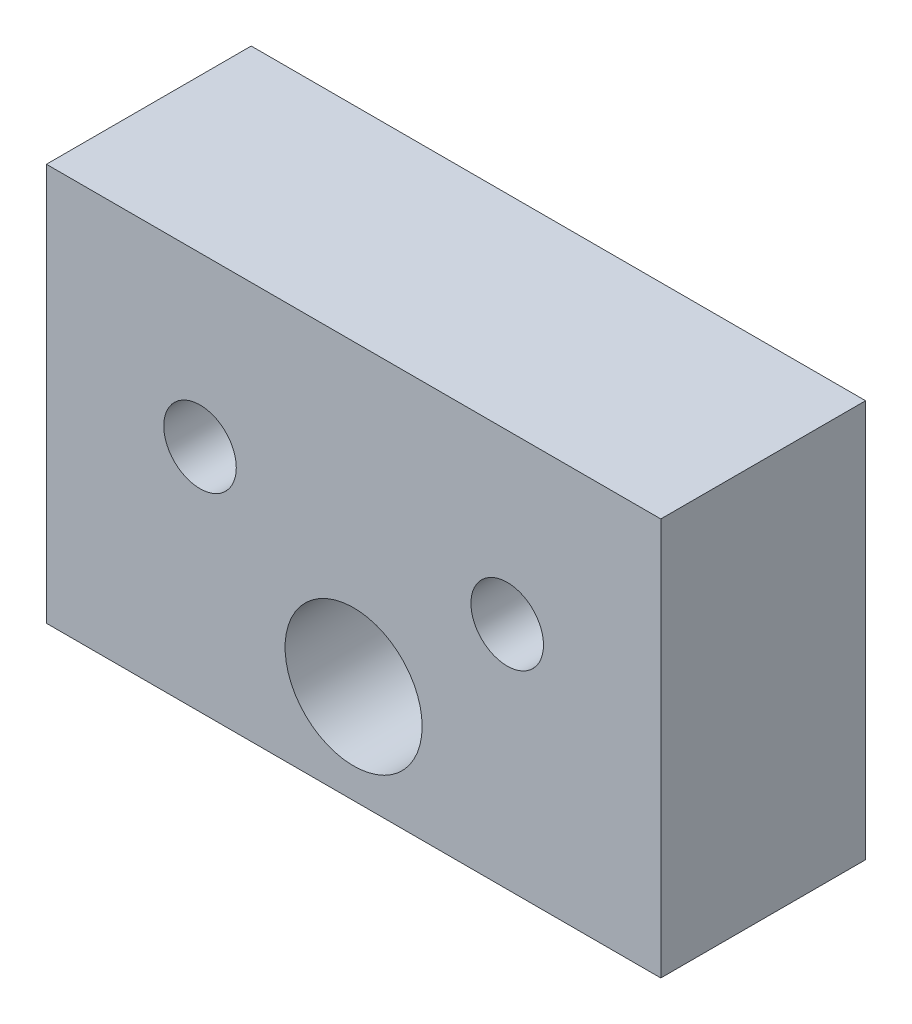
from build123d import *

# Parameters (mm, degrees)
SKETCH1_R           = 4.5
SKETCH1_R_2         = 8.5
BOSS_EXTRUDE1_DEPTH = 12.7


with BuildPart() as part:
    # Sketch1 → Boss-Extrude1 (new, symmetric)
    with BuildSketch(Plane.XY):
        Polygon((-38.1, 37.084), (38.1, 37.084), (38.1, 12.224), (38.1, -12.224), (-38.1, -12.224), (-38.1, 12.224), align=None)
        with Locations((-19.05, 16.256)):
            Circle(SKETCH1_R, mode=Mode.SUBTRACT)
        with Locations((19.05, 16.256)):
            Circle(SKETCH1_R, mode=Mode.SUBTRACT)
        Circle(SKETCH1_R_2, mode=Mode.SUBTRACT)
    extrude(amount=BOSS_EXTRUDE1_DEPTH, both=True)


solid = part.part
